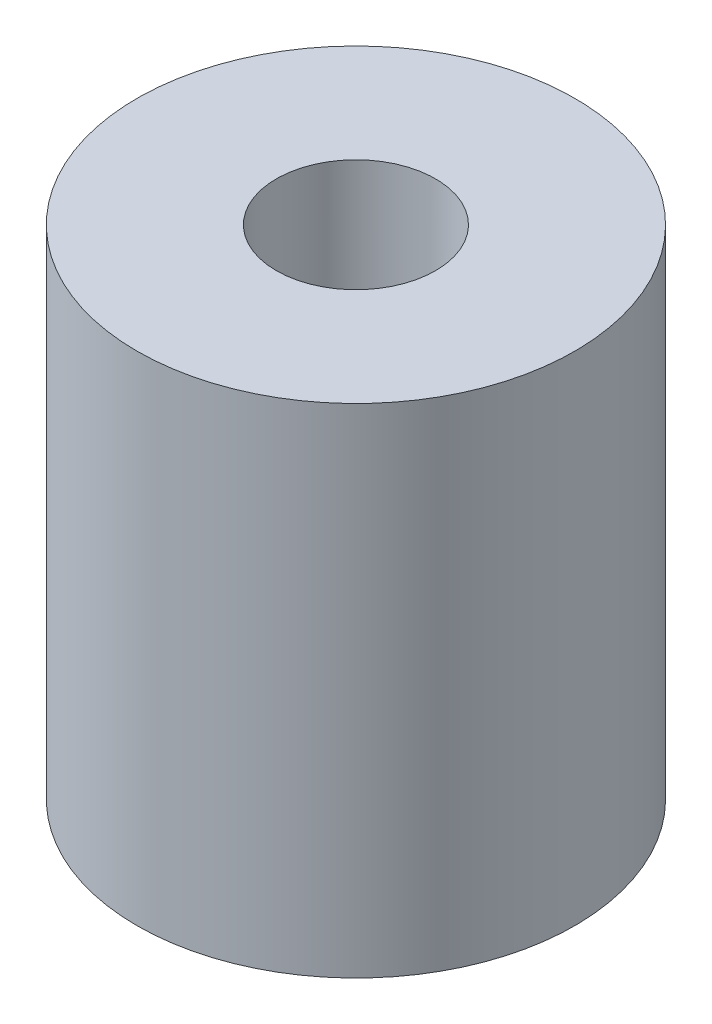
from build123d import *

# Parameters (mm, degrees)
SKETCH1_R           = 11
BOSS_EXTRUDE1_DEPTH = 25
SKETCH2_R           = 4
CUT_EXTRUDE1_DEPTH  = 30.444863729
CUT_EXTRUDE2_DEPTH  = 7.5
SKETCH4_R           = 1.5
CUT_EXTRUDE3_DEPTH  = 30.444863729
SKETCH5_R           = 1.5
CUT_EXTRUDE4_DEPTH  = 30.444863896
CUT_EXTRUDE5_START  = -10.2
SKETCH7_R           = 2.1
CUT_EXTRUDE5_DEPTH  = 10
CUT_EXTRUDE6_START  = -10.2
SKETCH8_R           = 2.1
CUT_EXTRUDE6_DEPTH  = 10


with BuildPart() as part:
    # Sketch1 → Boss-Extrude1 (new body)
    with BuildSketch(Plane(origin=(0, 0, 0), x_dir=(1, 0, 0), z_dir=(0, 1, 0))):
        with Locations(Location((0, 0, 0), (0, 0, 270))):
            Circle(SKETCH1_R)
    extrude(amount=BOSS_EXTRUDE1_DEPTH)

    # Sketch2 → Cut-Extrude1 (cut, through all)
    with BuildSketch(Plane(origin=(0, 25, 0), x_dir=(1, 0, 0), z_dir=(0, 1, 0))):
        with Locations(Location((0, 0, 0), (0, 0, 270))):
            Circle(SKETCH2_R)
    extrude(amount=-CUT_EXTRUDE1_DEPTH, mode=Mode.SUBTRACT)

    # Sketch3 → Cut-Extrude2 (cut)
    with BuildSketch(Plane.XZ):
        with BuildLine():
            Line((4.864454926, 3.520952041), (6.505382387, 5.161879503))
            Line((6.505382387, 5.161879503), (5.161879503, 6.505382387))
            Line((5.161879503, 6.505382387), (3.520952041, 4.864454926))
            ThreePointArc((3.520952041, 4.864454926), (2.298014011, 5.547896593), (0.95, 5.929378129))
            Line((0.95, 5.929378129), (0.95, 8.25))
            Line((0.95, 8.25), (-0.95, 8.25))
            Line((-0.95, 8.25), (-0.95, 5.929378129))
            ThreePointArc((-0.95, 5.929378129), (-2.298014011, 5.547896593), (-3.520952041, 4.864454926))
            Line((-3.520952041, 4.864454926), (-5.161879503, 6.505382387))
            Line((-5.161879503, 6.505382387), (-6.505382387, 5.161879503))
            Line((-6.505382387, 5.161879503), (-4.864454926, 3.520952041))
            ThreePointArc((-4.864454926, 3.520952041), (-5.547896593, 2.298014011), (-5.929378129, 0.95))
            Line((-5.929378129, 0.95), (-8.25, 0.95))
            Line((-8.25, 0.95), (-8.25, -0.95))
            Line((-8.25, -0.95), (-5.929378129, -0.95))
            ThreePointArc((-5.929378129, -0.95), (-5.547896593, -2.298014011), (-4.864454926, -3.520952041))
            Line((-4.864454926, -3.520952041), (-6.505382387, -5.161879503))
            Line((-6.505382387, -5.161879503), (-5.161879503, -6.505382387))
            Line((-5.161879503, -6.505382387), (-3.520952041, -4.864454926))
            ThreePointArc((-3.520952041, -4.864454926), (-2.298014011, -5.547896593), (-0.95, -5.929378129))
            Line((-0.95, -5.929378129), (-0.95, -8.25))
            Line((-0.95, -8.25), (0.95, -8.25))
            Line((0.95, -8.25), (0.95, -5.929378129))
            ThreePointArc((0.95, -5.929378129), (2.298014011, -5.547896593), (3.520952041, -4.864454926))
            Line((3.520952041, -4.864454926), (5.161879503, -6.505382387))
            Line((5.161879503, -6.505382387), (6.505382387, -5.161879503))
            Line((6.505382387, -5.161879503), (4.864454926, -3.520952041))
            ThreePointArc((4.864454926, -3.520952041), (5.547896593, -2.298014011), (5.929378129, -0.95))
            Line((5.929378129, -0.95), (8.25, -0.95))
            Line((8.25, -0.95), (8.25, 0.95))
            Line((8.25, 0.95), (5.929378129, 0.95))
            ThreePointArc((5.929378129, 0.95), (5.547896593, 2.298014011), (4.864454926, 3.520952041))
        make_face()
    extrude(amount=-CUT_EXTRUDE2_DEPTH, mode=Mode.SUBTRACT)

    # Sketch4 → Cut-Extrude3 (cut, through all)
    with BuildSketch(Plane.XY):
        with Locations((0, 19)):
            Circle(SKETCH4_R)
    extrude(amount=-CUT_EXTRUDE3_DEPTH, mode=Mode.SUBTRACT)

    # Sketch5 → Cut-Extrude4 (cut, through all)
    with BuildSketch(Plane(origin=(0, 0, 0), x_dir=(0, 0, -1), z_dir=(1, 0, 0))):
        with Locations((0, 19)):
            Circle(SKETCH5_R)
    extrude(amount=-CUT_EXTRUDE4_DEPTH, mode=Mode.SUBTRACT)

    # Sketch7 → Cut-Extrude5 (cut)
    with BuildSketch(Plane.XY.offset(CUT_EXTRUDE5_START)):
        with Locations((0, 19)):
            Circle(SKETCH7_R)
    extrude(amount=-CUT_EXTRUDE5_DEPTH, mode=Mode.SUBTRACT)

    # Sketch8 → Cut-Extrude6 (cut)
    with BuildSketch(Plane(origin=(0, 0, 0), x_dir=(0, 0, -1), z_dir=(1, 0, 0)).offset(CUT_EXTRUDE6_START)):
        with Locations((0, 19)):
            Circle(SKETCH8_R)
    extrude(amount=-CUT_EXTRUDE6_DEPTH, mode=Mode.SUBTRACT)


solid = part.part
